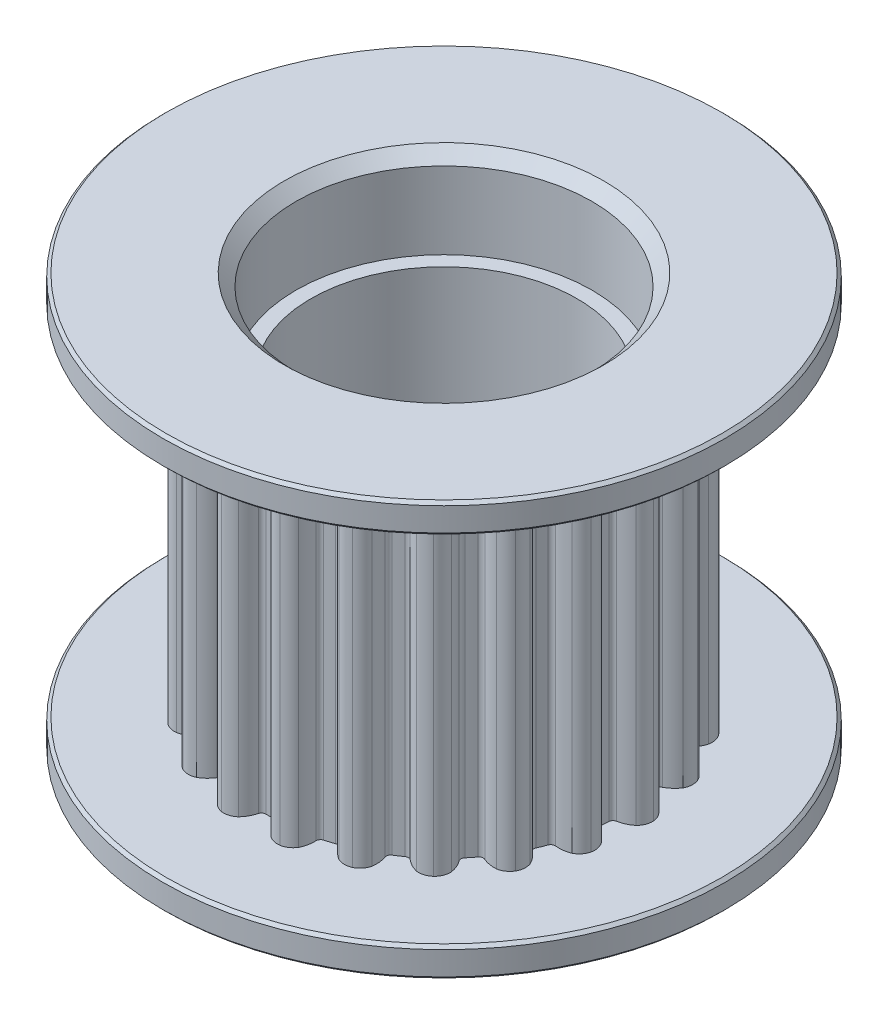
from build123d import *

# Parameters (mm, degrees)
GT2_PROFILE_REACH                 = 17.149
GT2_PROFILE_DIRECTION_2_REACH     = 17.149
GT2_GROOVE_CIRCULAR_PATTERN_COUNT = 21
INNER_CHAMFER_SIZE                = 0.4
OUTER_CHAMFER_SIZE                = 0.1


with BuildPart() as part:
    # Body Sketch → Body (revolve)
    with BuildSketch(Plane.XY, mode=Mode.PRIVATE) as body_sk:
        Polygon((6.61, -6), (6.61, 6), (9.5, 6), (9.5, 7), (5, 7), (5, 4), (4.5, 4), (4.5, -4), (5, -4), (5, -7), (9.5, -7), (9.5, -6), align=None)
    revolve(body_sk.sketch.rotate(Axis((0, 7, 0), (0, -1, 0)), 90), axis=Axis((0, 7, 0), (0, -1, 0)))

    # GT2 Profile: up to this face of the body (flat: up to its plane)
    gt2_profile_end = Plane(part.part.faces().sort_by_distance((0, -6, -9.231299423))[0])
    # GT2 Profile Sketch → GT2 Profile (cut, up to the picked face)
    with BuildSketch(Plane(origin=(0, 0, 0), x_dir=(1, 0, 0), z_dir=(0, 1, 0)), mode=Mode.PRIVATE) as gt2_profile_sk1:
        with BuildLine():
            ThreePointArc((0.308272131, -5.970161569), (0.253254379, -5.887927522), (0.158997879, -5.857842578))
            ThreePointArc((0.158997879, -5.857842578), (0, -5.86), (-0.158997879, -5.857842578))
            ThreePointArc((-0.158997879, -5.857842578), (-0.253254379, -5.887927522), (-0.308272131, -5.970161569))
            ThreePointArc((-0.308272131, -5.970161569), (-0.400297431, -6.201627509), (-0.546674497, -6.403168799))
            ThreePointArc((-0.546674497, -6.403168799), (-0.756901631, -6.518569015), (-0.996189791, -6.534501198))
            ThreePointArc((-0.996189791, -6.534501198), (0, -6.61), (0.996189791, -6.534501198))
            ThreePointArc((0.996189791, -6.534501198), (0.756901631, -6.518569015), (0.546674497, -6.403168799))
            ThreePointArc((0.546674497, -6.403168799), (0.400297431, -6.201627509), (0.308272131, -5.970161569))
        make_face()
    gt2_profile_tool1 = split(extrude(gt2_profile_sk1.sketch, amount=-GT2_PROFILE_REACH, mode=Mode.PRIVATE), bisect_by=gt2_profile_end, keep=Keep.BOTH, mode=Mode.PRIVATE)
    gt2_profile = gt2_profile_tool1.solids().sort_by(Axis((0, 0, 6.300828), (0, -1, 0)))[0]
    add(gt2_profile, mode=Mode.SUBTRACT)

    # GT2 Profile direction 2: up to this face of the body (flat: up to its plane)
    gt2_profile_direction_2_end = Plane(part.part.faces().sort_by_distance((0, 6, -6.878700577))[0])
    # GT2 Profile Sketch → GT2 Profile direction 2 (cut, up to the picked face)
    with BuildSketch(Plane(origin=(0, 0, 0), x_dir=(1, 0, 0), z_dir=(0, 1, 0)), mode=Mode.PRIVATE) as gt2_profile_direction_2_sk1:
        with BuildLine():
            ThreePointArc((0.308272131, -5.970161569), (0.253254379, -5.887927522), (0.158997879, -5.857842578))
            ThreePointArc((0.158997879, -5.857842578), (0, -5.86), (-0.158997879, -5.857842578))
            ThreePointArc((-0.158997879, -5.857842578), (-0.253254379, -5.887927522), (-0.308272131, -5.970161569))
            ThreePointArc((-0.308272131, -5.970161569), (-0.400297431, -6.201627509), (-0.546674497, -6.403168799))
            ThreePointArc((-0.546674497, -6.403168799), (-0.756901631, -6.518569015), (-0.996189791, -6.534501198))
            ThreePointArc((-0.996189791, -6.534501198), (0, -6.61), (0.996189791, -6.534501198))
            ThreePointArc((0.996189791, -6.534501198), (0.756901631, -6.518569015), (0.546674497, -6.403168799))
            ThreePointArc((0.546674497, -6.403168799), (0.400297431, -6.201627509), (0.308272131, -5.970161569))
        make_face()
    gt2_profile_direction_2_tool1 = split(extrude(gt2_profile_direction_2_sk1.sketch, amount=GT2_PROFILE_DIRECTION_2_REACH, mode=Mode.PRIVATE), bisect_by=gt2_profile_direction_2_end, keep=Keep.BOTH, mode=Mode.PRIVATE)
    gt2_profile_direction_2 = gt2_profile_direction_2_tool1.solids().sort_by(Axis((0, 0, 6.300828), (0, 1, 0)))[0]
    add(gt2_profile_direction_2, mode=Mode.SUBTRACT)

    # GT2 Groove Circular Pattern: GT2 Profile, GT2 Profile direction 2 ×21 about axis
    gt2_groove_circular_pattern_axis = Axis((0, 0, 0), (0, 1, 0))
    add([gt2_profile.rotate(gt2_groove_circular_pattern_axis, i * 360 / GT2_GROOVE_CIRCULAR_PATTERN_COUNT) for i in range(1, GT2_GROOVE_CIRCULAR_PATTERN_COUNT)], mode=Mode.SUBTRACT)
    add([gt2_profile_direction_2.rotate(gt2_groove_circular_pattern_axis, i * 360 / GT2_GROOVE_CIRCULAR_PATTERN_COUNT) for i in range(1, GT2_GROOVE_CIRCULAR_PATTERN_COUNT)], mode=Mode.SUBTRACT)

    # Inner Chamfer
    inner_chamfer_edges = [part.edges().sort_by_distance(p)[0] for p in [
        (0, -7, -5),
        (0, 7, -5),
    ]]
    chamfer(inner_chamfer_edges, length=INNER_CHAMFER_SIZE)

    # Outer Chamfer
    outer_chamfer_edges = [part.edges().sort_by_distance(p)[0] for p in [
        (0, 7, -9.5),
        (0, 6, -9.5),
        (0, -6, -9.5),
        (0, -7, -9.5),
    ]]
    chamfer(outer_chamfer_edges, length=OUTER_CHAMFER_SIZE)


solid = part.part
